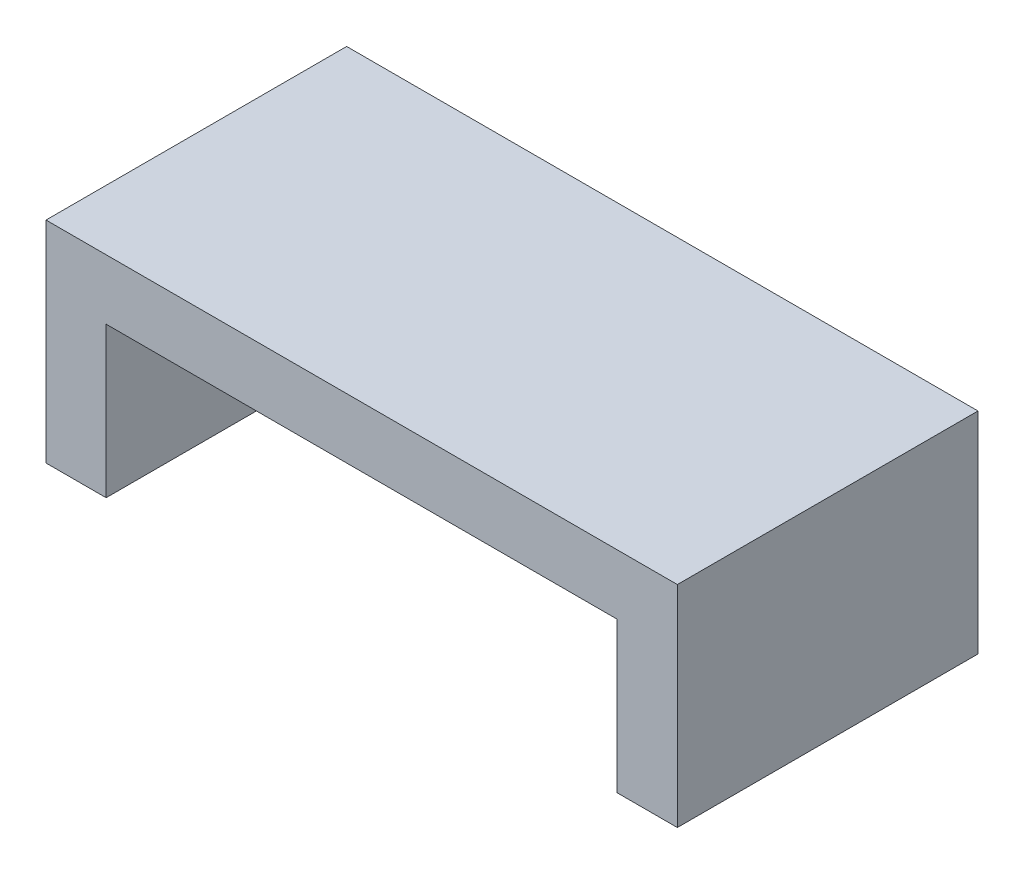
from build123d import *

# Parameters (mm, degrees)
SKETCH1_W           = 21
SKETCH1_H           = 10
BOSS_EXTRUDE1_DEPTH = 7
SKETCH2_W           = 17
SKETCH2_H           = 5
CUT_EXTRUDE1_DEPTH  = 10


with BuildPart() as part:
    # Sketch1 → Boss-Extrude1 (new body)
    with BuildSketch(Plane(origin=(0, 0, 0), x_dir=(1, 0, 0), z_dir=(0, 1, 0))):
        with Locations((2.759910232, 1.119822485)):
            Rectangle(SKETCH1_W, SKETCH1_H)
    extrude(amount=BOSS_EXTRUDE1_DEPTH)

    # Sketch2 → Cut-Extrude1 (cut)
    with BuildSketch(Plane.XY.offset(3.880177515)):
        with Locations((2.759910232, 2.5)):
            Rectangle(SKETCH2_W, SKETCH2_H)
    extrude(amount=-CUT_EXTRUDE1_DEPTH, mode=Mode.SUBTRACT)


solid = part.part
